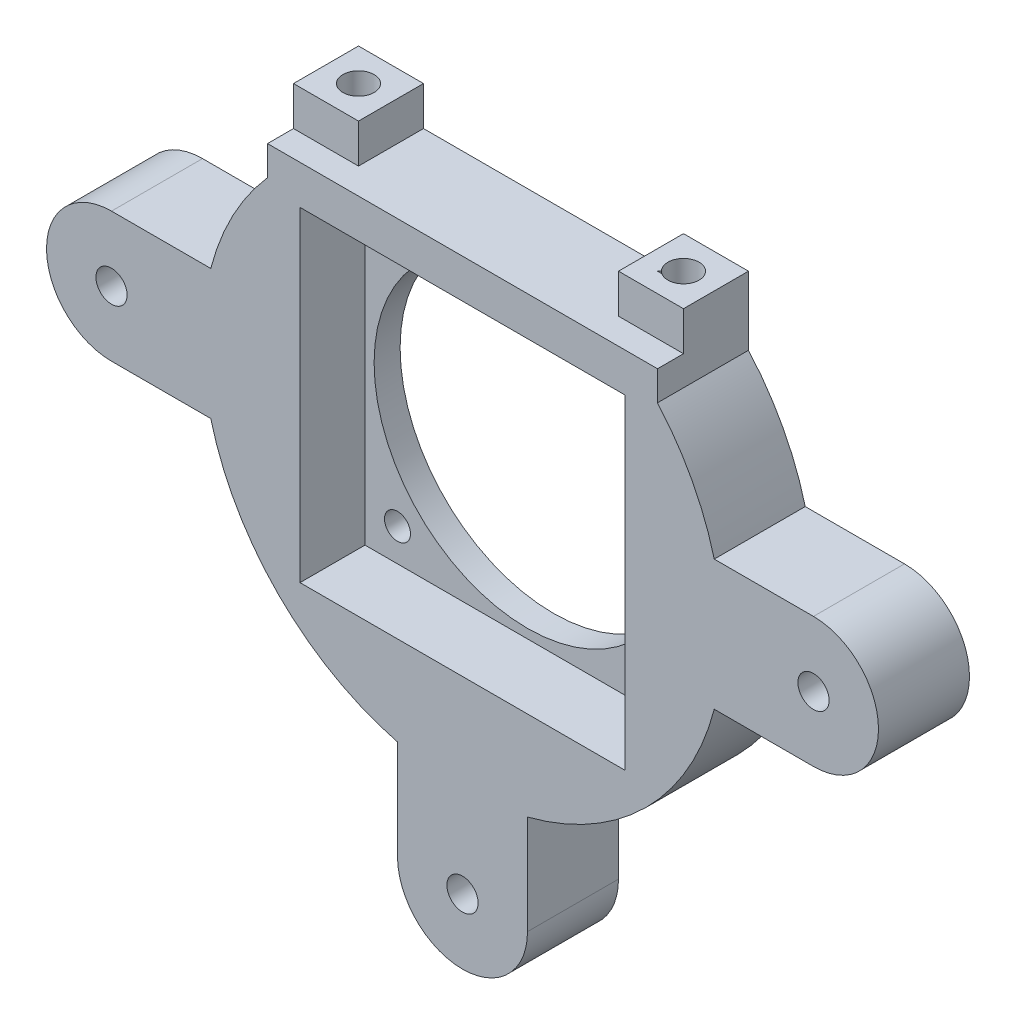
from build123d import *

# Parameters (mm, degrees)
SKETCH2_R           = 20
SKETCH2_W           = 25
SKETCH2_H           = 25
SKETCH2_R_2         = 11.8
SKETCH2_R_3         = 1
BOSS_EXTRUDE1_DEPTH = 2
SKETCH2_3_R         = 20
SKETCH2_3_W         = 25
SKETCH2_3_H         = 25
BOSS_EXTRUDE2_DEPTH = 7
SKETCH4_R           = 1.2
BOSS_EXTRUDE3_DEPTH = 7
CUT_EXTRUDE8_START  = -7
SKETCH5_R           = 1.2
CUT_EXTRUDE8_DEPTH  = 7
SKETCH8_W           = 30
SKETCH8_H           = 7
BOSS_EXTRUDE5_DEPTH = 2.5
SKETCH9_W           = 30
SKETCH9_H           = 1.472120536
CUT_EXTRUDE9_DEPTH  = 12.5
BOSS_EXTRUDE6_DEPTH = 3


with BuildPart() as part:
    # Sketch2 → Boss-Extrude1 (new body)
    # profile 1 of 2: a face of its own
    with BuildSketch(Plane(origin=(0, 0, 0), x_dir=(0, 1, 0), z_dir=(0, 0, 1))):
        with Locations(Location((0, 0, 0), (0, 0, 270))):
            Circle(SKETCH2_R)
        Rectangle(SKETCH2_W, SKETCH2_H, mode=Mode.SUBTRACT)
    # profile 2 of 2: a face of its own
    with BuildSketch(Plane(origin=(0, 0, 0), x_dir=(0, 1, 0), z_dir=(0, 0, 1))):
        Rectangle(SKETCH2_W, SKETCH2_H)
        with Locations(Location((0, 0, 0), (0, 0, 270))):
            Circle(SKETCH2_R_2, mode=Mode.SUBTRACT)
        with Locations(Location((-10, -10, 0), (0, 0, 270))):
            Circle(SKETCH2_R_3, mode=Mode.SUBTRACT)
        with Locations(Location((10, -10, 0), (0, 0, 270))):
            Circle(SKETCH2_R_3, mode=Mode.SUBTRACT)
        with Locations(Location((10, 10, 0), (0, 0, 270))):
            Circle(SKETCH2_R_3, mode=Mode.SUBTRACT)
        with Locations(Location((-10, 10, 0), (0, 0, 270))):
            Circle(SKETCH2_R_3, mode=Mode.SUBTRACT)
    extrude(amount=BOSS_EXTRUDE1_DEPTH)

    # Sketch2<3> → Boss-Extrude2 (add)
    with BuildSketch(Plane(origin=(0, 0, 0), x_dir=(0, 1, 0), z_dir=(0, 0, 1))):
        with Locations(Location((0, 0, 0), (0, 0, 270))):
            Circle(SKETCH2_3_R)
        Rectangle(SKETCH2_3_W, SKETCH2_3_H, mode=Mode.SUBTRACT)
    extrude(amount=BOSS_EXTRUDE2_DEPTH)

    # Sketch4 → Boss-Extrude3 (add)
    # profile 1 of 4: a face of its own
    with BuildSketch(Plane(origin=(0, 0, 0), x_dir=(1, 0, 0), z_dir=(0, 0, -1))):
        with BuildLine():
            ThreePointArc((19.364916731, 5), (20, 0), (19.364916731, -5))
            Line((19.364916731, -5), (27, -5))
            ThreePointArc((27, -5), (32, 0), (27, 5))
            Line((27, 5), (19.364916731, 5))
        make_face()
        with Locations(Location((27, 0, 0), (0, 0, 180))):
            Circle(SKETCH4_R, mode=Mode.SUBTRACT)
    # profile 2 of 4: a face of its own
    with BuildSketch(Plane(origin=(0, 0, 0), x_dir=(1, 0, 0), z_dir=(0, 0, -1))):
        with BuildLine():
            ThreePointArc((-5, 19.364916731), (0, 20), (5, 19.364916731))
            Line((5, 19.364916731), (5, 27))
            ThreePointArc((5, 27), (0, 32), (-5, 27))
            Line((-5, 27), (-5, 19.364916731))
        make_face()
        with Locations(Location((0, 27, 0), (0, 0, 180))):
            Circle(SKETCH4_R, mode=Mode.SUBTRACT)
    # profile 3 of 4: a face of its own
    with BuildSketch(Plane(origin=(0, 0, 0), x_dir=(1, 0, 0), z_dir=(0, 0, -1))):
        with BuildLine():
            Line((5, -27), (5, -19.364916731))
            ThreePointArc((5, -19.364916731), (0, -20), (-5, -19.364916731))
            Line((-5, -19.364916731), (-5, -27))
            ThreePointArc((-5, -27), (0, -32), (5, -27))
        make_face()
        with Locations(Location((0, -27, 0), (0, 0, 180))):
            Circle(SKETCH4_R, mode=Mode.SUBTRACT)
    # profile 4 of 4: a face of its own
    with BuildSketch(Plane(origin=(0, 0, 0), x_dir=(1, 0, 0), z_dir=(0, 0, -1))):
        with BuildLine():
            ThreePointArc((-19.364916731, -5), (-20, 0), (-19.364916731, 5))
            Line((-19.364916731, 5), (-27, 5))
            ThreePointArc((-27, 5), (-32, 0), (-27, -5))
            Line((-27, -5), (-19.364916731, -5))
        make_face()
        with Locations(Location((-27, 0, 0), (0, 0, 180))):
            Circle(SKETCH4_R, mode=Mode.SUBTRACT)
    extrude(amount=-BOSS_EXTRUDE3_DEPTH)

    # Sketch5 → Cut-Extrude8 (cut)
    with BuildSketch(Plane.XY.offset(7).offset(CUT_EXTRUDE8_START)):
        with BuildLine():
            Line((-12.5, 15.612494996), (-12.5, 15.5))
            Line((-12.5, 15.5), (12.5, 15.5))
            Line((12.5, 15.5), (12.5, 15.612494996))
            ThreePointArc((12.5, 15.612494996), (8.948891955, 17.886233052), (5, 19.364916731))
            Line((5, 19.364916731), (5, 27))
            ThreePointArc((5, 27), (0, 32), (-5, 27))
            Line((-5, 27), (-5, 19.364916731))
            ThreePointArc((-5, 19.364916731), (-8.948891955, 17.886233052), (-12.5, 15.612494996))
        make_face()
        with Locations((0, 27)):
            Circle(SKETCH5_R, mode=Mode.SUBTRACT)
    extrude(amount=CUT_EXTRUDE8_DEPTH, mode=Mode.SUBTRACT)

    # Sketch8 → Boss-Extrude5 (add)
    with BuildSketch(Plane(origin=(0, 15.5, 0), x_dir=(-1, 0, 0), z_dir=(0, 1, 0))):
        with Locations((0, 3.5)):
            Rectangle(SKETCH8_W, SKETCH8_H)
    extrude(amount=-BOSS_EXTRUDE5_DEPTH)

    # Sketch9 → Cut-Extrude9 (cut)
    with BuildSketch(Plane.XY.offset(7)):
        with Locations((0, 16.236060268)):
            Rectangle(SKETCH9_W, SKETCH9_H)
    extrude(amount=-CUT_EXTRUDE9_DEPTH, mode=Mode.SUBTRACT)

    # Sketch8<5> → Boss-Extrude6 (add)
    with BuildSketch(Plane(origin=(0, 15.5, 0), x_dir=(-1, 0, 0), z_dir=(0, 1, 0))):
        with BuildLine():
            Line((-10, 3.5), (-11.5, 3.5))
            Line((-11.5, 3.5), (-11.651471863, 3.348528137))
            ThreePointArc((-11.651471863, 3.348528137), (-11.391344561, 2.959220119), (-11.3, 2.5))
            ThreePointArc((-11.3, 2.5), (-11.651471863, 1.651471863), (-12.5, 1.3))
            Line((-12.5, 1.3), (-12.5, 0))
            Line((-12.5, 0), (-10, 0))
            Line((-10, 0), (-10, 3.5))
        make_face()
        with BuildLine():
            ThreePointArc((-12.5, 1.3), (-12.959220119, 1.391344561), (-13.348528137, 1.651471863))
            Line((-13.348528137, 1.651471863), (-15, 0))
            Line((-15, 0), (-12.5, 0))
            Line((-12.5, 0), (-12.5, 1.3))
        make_face()
        with BuildLine():
            ThreePointArc((-13.348528137, 1.651471863), (-13.608655439, 2.959220119), (-12.5, 3.7))
            Line((-12.5, 3.7), (-12.5, 5))
            Line((-12.5, 5), (-15, 5))
            Line((-15, 5), (-15, 0))
            Line((-15, 0), (-13.348528137, 1.651471863))
        make_face()
        with BuildLine():
            ThreePointArc((-12.5, 3.7), (-12.153589838, 3.648912529), (-11.836675042, 3.5))
            Line((-11.836675042, 3.5), (-11.5, 3.5))
            Line((-11.5, 3.5), (-10, 5))
            Line((-10, 5), (-12.5, 5))
            Line((-12.5, 5), (-12.5, 3.7))
        make_face()
        Polygon((-10, 5), (-11.5, 3.5), (-10, 3.5), align=None)
        with BuildLine():
            Line((11.836675042, 3.5), (10, 3.5))
            Line((10, 3.5), (10, 0))
            Line((10, 0), (12.5, 0))
            Line((12.5, 0), (12.5, 1.3))
            ThreePointArc((12.5, 1.3), (11.351087471, 2.153589838), (11.836675042, 3.5))
        make_face()
        with BuildLine():
            Line((10, 5), (10, 3.5))
            Line((10, 3.5), (11.836675042, 3.5))
            ThreePointArc((11.836675042, 3.5), (12.153589838, 3.648912529), (12.5, 3.7))
            Line((12.5, 3.7), (12.5, 5))
            Line((12.5, 5), (10, 5))
        make_face()
        with BuildLine():
            Line((15, 5), (12.5, 5))
            Line((12.5, 5), (12.5, 3.7))
            ThreePointArc((12.5, 3.7), (13.348528137, 3.348528137), (13.7, 2.5))
            ThreePointArc((13.7, 2.5), (13.348528137, 1.651471863), (12.5, 1.3))
            Line((12.5, 1.3), (12.5, 0))
            Line((12.5, 0), (15, 0))
            Line((15, 0), (15, 5))
        make_face()
    extrude(amount=BOSS_EXTRUDE6_DEPTH)


solid = part.part
